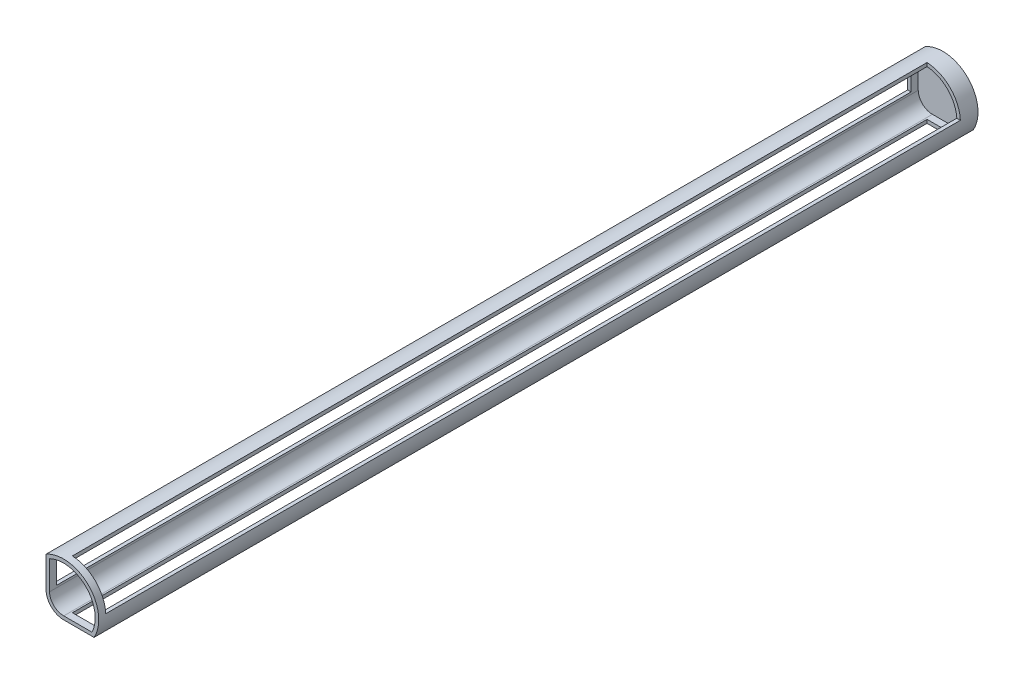
from build123d import *

# Parameters (mm, degrees)
RESSALTO_EXTRUS_O1_DEPTH = 250
CORTE_EXTRUS_O1_DEPTH    = 247
ESBO_O4_W                = 7.5
ESBO_O4_H                = 243
CORTE_EXTRUS_O2_DEPTH    = 245
ESBO_O5_W                = 243
ESBO_O5_H                = 7.5
CORTE_EXTRUS_O3_DEPTH    = 245


with BuildPart() as part:
    # Esboço2 → Ressalto-extrusão1 (new body)
    with BuildSketch(Plane.XY):
        with BuildLine():
            Line((-7.5, 6.160254038), (-7.5, -2.5))
            ThreePointArc((-7.5, -2.5), (-6.035533906, -6.035533906), (-2.5, -7.5))
            Line((-2.5, -7.5), (6.160254038, -7.5))
            ThreePointArc((6.160254038, -7.5), (4.571067812, 4.571067812), (-7.5, 6.160254038))
        make_face()
    extrude(amount=RESSALTO_EXTRUS_O1_DEPTH)

    # Esboço3 → Corte-extrusão1 (cut)
    with BuildSketch(Plane.XY.offset(250)):
        with BuildLine():
            Line((-6.5, 5.562257748), (-6.5, -2.595115556))
            ThreePointArc((-6.5, -2.595115556), (-5.287772695, -5.384664894), (-2.458089295, -6.5))
            Line((-2.458089295, -6.5), (0.796633642, -6.5))
            Line((0.796633642, -6.5), (5.562257748, -6.5))
            ThreePointArc((5.562257748, -6.5), (3.845180245, 3.845180245), (-6.5, 5.562257748))
        make_face()
    extrude(amount=-CORTE_EXTRUS_O1_DEPTH, mode=Mode.SUBTRACT)

    # Esboço4 → Corte-extrusão2 (cut)
    with BuildSketch(Plane.XZ.offset(7.5)):
        with Locations((1.75, 126.5)):
            Rectangle(ESBO_O4_W, ESBO_O4_H)
    extrude(amount=-CORTE_EXTRUS_O2_DEPTH, mode=Mode.SUBTRACT)

    # Esboço5 → Corte-extrusão3 (cut)
    with BuildSketch(Plane.ZY.offset(7.5)):
        with Locations((126.5, 1.75)):
            Rectangle(ESBO_O5_W, ESBO_O5_H)
    extrude(amount=-CORTE_EXTRUS_O3_DEPTH, mode=Mode.SUBTRACT)


solid = part.part
